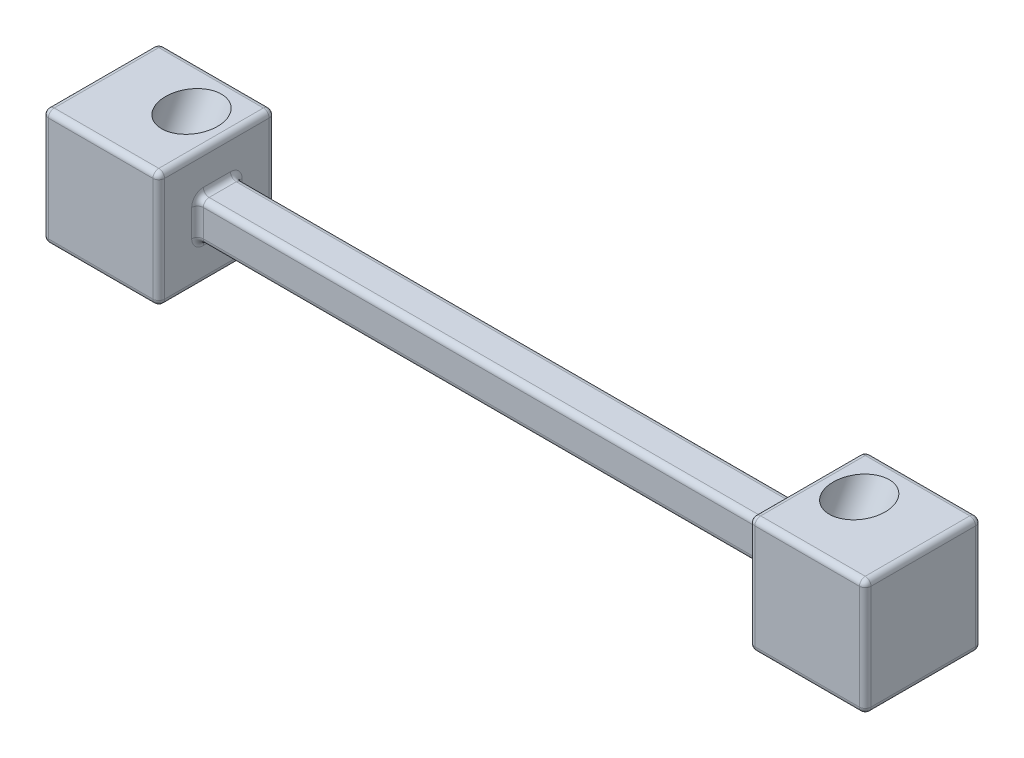
from build123d import *

# Parameters (mm, degrees)
SKETCH1_W           = 30
SKETCH1_H           = 30
BOSS_EXTRUDE1_DEPTH = 30
SKETCH2_W           = 10
SKETCH2_H           = 10
BOSS_EXTRUDE2_DEPTH = 152.4
SKETCH3_W           = 6
SKETCH3_H           = 6
CUT_EXTRUDE1_DEPTH  = 152.4
SKETCH6_R           = 4.5
CUT_EXTRUDE2_DEPTH  = 15
SKETCH7_R           = 6.7
CUT_EXTRUDE3_DEPTH  = 20
FILLET1_R           = 1.5


with BuildPart() as part:
    # Sketch1 → Boss-Extrude1 (new body)
    with BuildSketch(Plane(origin=(0, 0, 0), x_dir=(0, 0, -1), z_dir=(1, 0, 0))):
        with Locations((-2.320508076, 15)):
            Rectangle(SKETCH1_W, SKETCH1_H)
    boss_extrude1 = extrude(amount=BOSS_EXTRUDE1_DEPTH)

    # Sketch2 → Boss-Extrude2 (add)
    with BuildSketch(Plane(origin=(30, 0, 0), x_dir=(0, 0, -1), z_dir=(1, 0, 0))):
        with Locations((-2.320508076, 15)):
            Rectangle(SKETCH2_W, SKETCH2_H)
    extrude(amount=BOSS_EXTRUDE2_DEPTH)

    # Sketch3 → Cut-Extrude1 (cut)
    with BuildSketch(Plane(origin=(182.4, 0, 0), x_dir=(0, 0, -1), z_dir=(1, 0, 0))):
        with Locations((-2.320508076, 15)):
            Rectangle(SKETCH3_W, SKETCH3_H)
    extrude(amount=-CUT_EXTRUDE1_DEPTH, mode=Mode.SUBTRACT)

    # Sketch6 → Cut-Extrude2 (cut)
    with BuildSketch(Plane(origin=(0, 0, -12.679491924), x_dir=(-1, 0, 0), z_dir=(0, 0, -1))):
        with Locations(Location((-10, 15, 0), (0, 0, 90))):
            Circle(SKETCH6_R)
    cut_extrude2 = extrude(amount=-CUT_EXTRUDE2_DEPTH, mode=Mode.SUBTRACT)

    # Sketch7 → Cut-Extrude3 (cut)
    with BuildSketch(Plane(origin=(0, 27.990381057, -16.160254038), x_dir=(-1, 0, 0), z_dir=(0, 0.8660254037844349, -0.5000000000000066))):
        with Locations(Location((-20, 14.019237886, 0), (0, 0, 90))):
            Circle(SKETCH7_R)
    cut_extrude3 = extrude(amount=-CUT_EXTRUDE3_DEPTH, mode=Mode.SUBTRACT)

    # Mirror1: Boss-Extrude1, Cut-Extrude2, Cut-Extrude3 across plane
    add(boss_extrude1.mirror(Plane(origin=(106.2, 0, 0), x_dir=(0, 0, 1), z_dir=(1, 0, 0))))
    add(cut_extrude2.mirror(Plane(origin=(106.2, 0, 0), x_dir=(0, 0, 1), z_dir=(1, 0, 0))), mode=Mode.SUBTRACT)
    add(cut_extrude3.mirror(Plane(origin=(106.2, 0, 0), x_dir=(0, 0, 1), z_dir=(1, 0, 0))), mode=Mode.SUBTRACT)

    # Fillet1
    fillet1_edges = [part.edges().sort_by_distance(p)[0] for p in [
        (30, 0, 2.320508076),
        (30, 15, 7.320508076),
        (106.2, 20, 7.320508076),
        (30, 10, 2.320508076),
        (106.2, 10, 7.320508076),
        (30, 15, -2.679491924),
        (106.2, 10, -2.679491924),
        (30, 20, 2.320508076),
        (106.2, 20, -2.679491924),
        (30, 15, -12.679491924),
        (182.4, 15, 7.320508076),
        (182.4, 10, 2.320508076),
        (182.4, 15, -2.679491924),
        (182.4, 20, 2.320508076),
        (106.2, 12, -0.679491924),
        (30, 30, 2.320508076),
        (0, 15, -12.679491924),
        (0, 0, 2.320508076),
        (0, 15, 17.320508076),
        (182.4, 30, 2.320508076),
        (197.4, 30, 17.320508076),
        (212.4, 15, -12.679491924),
        (197.4, 30, -12.679491924),
        (182.4, 0, 2.320508076),
        (197.4, 0, -12.679491924),
        (182.4, 15, 17.320508076),
        (197.4, 0, 17.320508076),
        (182.4, 15, -12.679491924),
        (212.4, 30, 2.320508076),
        (212.4, 15, 17.320508076),
        (212.4, 0, 2.320508076),
        (0, 30, 2.320508076),
        (15, 30, -12.679491924),
        (15, 0, -12.679491924),
        (15, 0, 17.320508076),
        (15, 30, 17.320508076),
        (30, 15, 17.320508076),
    ]]
    fillet(fillet1_edges, radius=FILLET1_R)


solid = part.part
